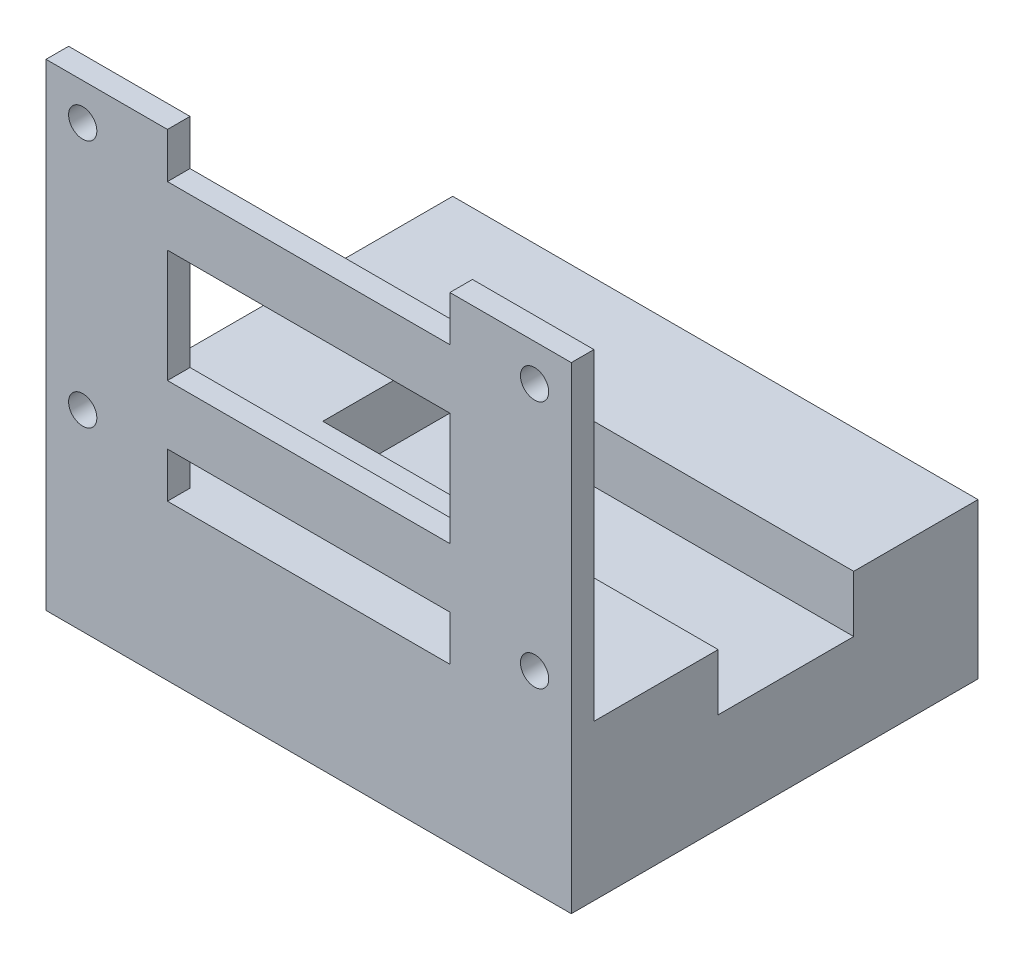
from build123d import *

# Parameters (mm, degrees)
SKETCH1_W           = 46.5
SKETCH1_H           = 34
BOSS_EXTRUDE1_DEPTH = 13.75
SKETCH2_W           = 46.5
SKETCH2_H           = 42.25
BOSS_EXTRUDE2_DEPTH = 2
CUT_EXTRUDE1_REACH  = 62.18
SKETCH3_R           = 1.25
SKETCH3_W           = 25
SKETCH3_H           = 10
SKETCH4_W           = 35
SKETCH4_H           = 12
CUT_EXTRUDE2_DEPTH  = 5
SKETCH6_R           = 2
CUT_EXTRUDE3_DEPTH  = 10
SKETCH7_W           = 25
SKETCH7_H           = 4
CUT_EXTRUDE4_DEPTH  = 10


with BuildPart() as part:
    # Sketch1 → Boss-Extrude1 (new body)
    with BuildSketch(Plane(origin=(0, 0, 0), x_dir=(1, 0, 0), z_dir=(0, 1, 0))):
        Rectangle(SKETCH1_W, SKETCH1_H)
    extrude(amount=BOSS_EXTRUDE1_DEPTH)

    # Sketch2 → Boss-Extrude2 (add)
    with BuildSketch(Plane.XY.offset(17)):
        with Locations((0, 21.125)):
            Rectangle(SKETCH2_W, SKETCH2_H)
    extrude(amount=BOSS_EXTRUDE2_DEPTH)

    # Sketch3 → Cut-Extrude1 (cut, up to next)
    with BuildSketch(Plane.XY.offset(19), mode=Mode.PRIVATE) as cut_extrude1_sk1:
        with Locations((-20, 39)):
            Circle(SKETCH3_R)
    cut_extrude1_tool1 = extrude(cut_extrude1_sk1.sketch, amount=-CUT_EXTRUDE1_REACH, mode=Mode.PRIVATE) & part.part
    # Sketch3 → Cut-Extrude1 (cut, up to next)
    with BuildSketch(Plane.XY.offset(19), mode=Mode.PRIVATE) as cut_extrude1_sk2:
        with Locations(Location((20, 39, 0), (0, 0, 180))):
            Circle(SKETCH3_R)
    cut_extrude1_tool2 = extrude(cut_extrude1_sk2.sketch, amount=-CUT_EXTRUDE1_REACH, mode=Mode.PRIVATE) & part.part
    # Sketch3 → Cut-Extrude1 (cut, up to next)
    with BuildSketch(Plane.XY.offset(19), mode=Mode.PRIVATE) as cut_extrude1_sk3:
        with Locations((20, 17)):
            Circle(SKETCH3_R)
    cut_extrude1_tool3 = extrude(cut_extrude1_sk3.sketch, amount=-CUT_EXTRUDE1_REACH, mode=Mode.PRIVATE) & part.part
    # Sketch3 → Cut-Extrude1 (cut, up to next)
    with BuildSketch(Plane.XY.offset(19), mode=Mode.PRIVATE) as cut_extrude1_sk4:
        with Locations(Location((-20, 17, 0), (0, 0, 180))):
            Circle(SKETCH3_R)
    cut_extrude1_tool4 = extrude(cut_extrude1_sk4.sketch, amount=-CUT_EXTRUDE1_REACH, mode=Mode.PRIVATE) & part.part
    # Sketch3 → Cut-Extrude1 (cut, up to next)
    with BuildSketch(Plane.XY.offset(19), mode=Mode.PRIVATE) as cut_extrude1_sk5:
        with Locations((0, 28)):
            Rectangle(SKETCH3_W, SKETCH3_H)
    cut_extrude1_tool5 = extrude(cut_extrude1_sk5.sketch, amount=-CUT_EXTRUDE1_REACH, mode=Mode.PRIVATE) & part.part
    add(cut_extrude1_tool1.solids().sort_by_distance((-20, 39, 19))[0], mode=Mode.SUBTRACT)
    add(cut_extrude1_tool2.solids().sort_by_distance((20, 39, 19))[0], mode=Mode.SUBTRACT)
    add(cut_extrude1_tool3.solids().sort_by_distance((20, 17, 19))[0], mode=Mode.SUBTRACT)
    add(cut_extrude1_tool4.solids().sort_by_distance((-20, 17, 19))[0], mode=Mode.SUBTRACT)
    add(cut_extrude1_tool5.solids().sort_by_distance((0, 28, 19))[0], mode=Mode.SUBTRACT)

    # Sketch4 → Cut-Extrude2 (cut)
    with BuildSketch(Plane(origin=(0, 13.75, 0), x_dir=(1, 0, 0), z_dir=(0, 1, 0))):
        with Locations((5.75, 0)):
            Rectangle(SKETCH4_W, SKETCH4_H)
    extrude(amount=-CUT_EXTRUDE2_DEPTH, mode=Mode.SUBTRACT)

    # Sketch6 → Cut-Extrude3 (cut)
    with BuildSketch(Plane.XZ):
        with Locations(Location((16.25, -10, 0), (0, 0, 270))):
            Circle(SKETCH6_R)
        with Locations(Location((16.25, 12, 0), (0, 0, 270))):
            Circle(SKETCH6_R)
        with Locations(Location((-16.25, -10, 0), (0, 0, 270))):
            Circle(SKETCH6_R)
        with Locations(Location((-16.25, 12, 0), (0, 0, 270))):
            Circle(SKETCH6_R)
    extrude(amount=-CUT_EXTRUDE3_DEPTH, mode=Mode.SUBTRACT)

    # Sketch7 → Cut-Extrude4 (cut)
    with BuildSketch(Plane(origin=(0, 0, 17), x_dir=(-1, 0, 0), z_dir=(0, 0, -1))):
        with Locations((0, 15.75)):
            Rectangle(SKETCH7_W, SKETCH7_H)
        with Locations((0, 40.25)):
            Rectangle(SKETCH7_W, SKETCH7_H)
    extrude(amount=-CUT_EXTRUDE4_DEPTH, mode=Mode.SUBTRACT)


solid = part.part
